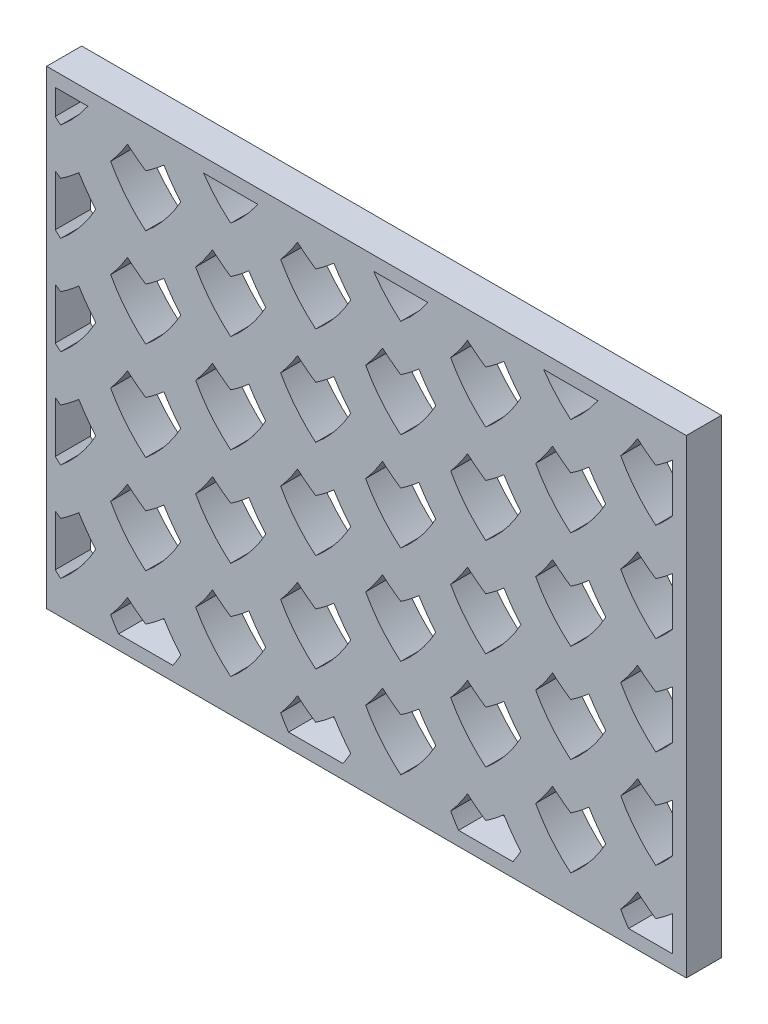
from build123d import *

# Parameters (mm, degrees)
SKETCH3_W           = 88
SKETCH3_H           = 63
BOSS_EXTRUDE2_DEPTH = 5
CUT_EXTRUDE1_DEPTH  = 70.169565835
SKETCH4_W           = 91.228796668
SKETCH4_H           = 67
SKETCH4_W_2         = 88
SKETCH4_H_2         = 63
BOSS_EXTRUDE3_DEPTH = 5


with BuildPart() as part:
    # Sketch3 → Boss-Extrude2 (new body)
    with BuildSketch(Plane.XY):
        with Locations((-6.36239225, 15.649319027)):
            Rectangle(SKETCH3_W, SKETCH3_H)
    extrude(amount=BOSS_EXTRUDE2_DEPTH)

    # Sketch1 → Cut-Extrude1 (cut, through all)
    with BuildSketch(Plane.XY):
        with BuildLine():
            ThreePointArc((-49.591188918, -69.117920678), (-52.373582004, -66.304029643), (-54.591247647, -63.026583512))
            ThreePointArc((-54.591247647, -63.026583512), (-53.31892615, -61.410320298), (-52.185319607, -59.693915634))
            ThreePointArc((-52.185319607, -59.693915634), (-50.921473659, -60.738490347), (-49.591188918, -61.697023298))
            ThreePointArc((-49.591188918, -61.697023298), (-48.260904177, -60.738490347), (-46.997058229, -59.693915634))
            ThreePointArc((-46.997058229, -59.693915634), (-45.863451685, -61.410320298), (-44.591130189, -63.026583512))
            ThreePointArc((-44.591130189, -63.026583512), (-46.808795832, -66.304029643), (-49.591188918, -69.117920678))
        make_face()
        with BuildLine():
            ThreePointArc((-37.466833265, -62.117920678), (-40.249226351, -59.304029643), (-42.466891994, -56.026583512))
            ThreePointArc((-42.466891994, -56.026583512), (-41.194570497, -54.410320298), (-40.060963954, -52.693915634))
            ThreePointArc((-40.060963954, -52.693915634), (-38.797118006, -53.738490347), (-37.466833265, -54.697023298))
            ThreePointArc((-37.466833265, -54.697023298), (-36.136548524, -53.738490347), (-34.872702576, -52.693915634))
            ThreePointArc((-34.872702576, -52.693915634), (-33.739096033, -54.410320298), (-32.466774536, -56.026583512))
            ThreePointArc((-32.466774536, -56.026583512), (-34.684440179, -59.304029643), (-37.466833265, -62.117920678))
        make_face()
        with BuildLine():
            ThreePointArc((-25.342477612, -55.117920678), (-28.124870698, -52.304029643), (-30.342536341, -49.026583512))
            ThreePointArc((-30.342536341, -49.026583512), (-29.070214844, -47.410320298), (-27.936608301, -45.693915634))
            ThreePointArc((-27.936608301, -45.693915634), (-26.672762353, -46.738490347), (-25.342477612, -47.697023298))
            ThreePointArc((-25.342477612, -47.697023298), (-24.012192871, -46.738490347), (-22.748346923, -45.693915634))
            ThreePointArc((-22.748346923, -45.693915634), (-21.61474038, -47.410320298), (-20.342418883, -49.026583512))
            ThreePointArc((-20.342418883, -49.026583512), (-22.560084526, -52.304029643), (-25.342477612, -55.117920678))
        make_face()
        with BuildLine():
            ThreePointArc((-13.218121959, -48.117920678), (-16.000515045, -45.304029643), (-18.218180688, -42.026583512))
            ThreePointArc((-18.218180688, -42.026583512), (-16.945859191, -40.410320298), (-15.812252648, -38.693915634))
            ThreePointArc((-15.812252648, -38.693915634), (-14.5484067, -39.738490347), (-13.218121959, -40.697023298))
            ThreePointArc((-13.218121959, -40.697023298), (-11.887837218, -39.738490347), (-10.62399127, -38.693915634))
            ThreePointArc((-10.62399127, -38.693915634), (-9.490384727, -40.410320298), (-8.21806323, -42.026583512))
            ThreePointArc((-8.21806323, -42.026583512), (-10.435728873, -45.304029643), (-13.218121959, -48.117920678))
        make_face()
        with BuildLine():
            ThreePointArc((-1.093766306, -41.117920678), (-3.876159392, -38.304029643), (-6.093825035, -35.026583512))
            ThreePointArc((-6.093825035, -35.026583512), (-4.821503538, -33.410320298), (-3.687896995, -31.693915634))
            ThreePointArc((-3.687896995, -31.693915634), (-2.424051047, -32.738490347), (-1.093766306, -33.697023298))
            ThreePointArc((-1.093766306, -33.697023298), (0.236518435, -32.738490347), (1.500364383, -31.693915634))
            ThreePointArc((1.500364383, -31.693915634), (2.633970926, -33.410320298), (3.906292423, -35.026583512))
            ThreePointArc((3.906292423, -35.026583512), (1.68862678, -38.304029643), (-1.093766306, -41.117920678))
        make_face()
        with BuildLine():
            ThreePointArc((11.030589347, -34.117920678), (8.248196261, -31.304029643), (6.030530618, -28.026583512))
            ThreePointArc((6.030530618, -28.026583512), (7.302852115, -26.410320298), (8.436458658, -24.693915634))
            ThreePointArc((8.436458658, -24.693915634), (9.700304606, -25.738490347), (11.030589347, -26.697023298))
            ThreePointArc((11.030589347, -26.697023298), (12.360874088, -25.738490347), (13.624720036, -24.693915634))
            ThreePointArc((13.624720036, -24.693915634), (14.758326579, -26.410320298), (16.030648076, -28.026583512))
            ThreePointArc((16.030648076, -28.026583512), (13.812982433, -31.304029643), (11.030589347, -34.117920678))
        make_face()
        with BuildLine():
            ThreePointArc((23.154945, -27.117920678), (20.372551914, -24.304029643), (18.154886271, -21.026583512))
            ThreePointArc((18.154886271, -21.026583512), (19.427207768, -19.410320298), (20.560814311, -17.693915634))
            ThreePointArc((20.560814311, -17.693915634), (21.824660259, -18.738490347), (23.154945, -19.697023298))
            ThreePointArc((23.154945, -19.697023298), (24.485229741, -18.738490347), (25.749075689, -17.693915634))
            ThreePointArc((25.749075689, -17.693915634), (26.882682232, -19.410320298), (28.155003729, -21.026583512))
            ThreePointArc((28.155003729, -21.026583512), (25.937338086, -24.304029643), (23.154945, -27.117920678))
        make_face()
        with BuildLine():
            ThreePointArc((35.279300653, -20.117920678), (32.496907567, -17.304029643), (30.279241924, -14.026583512))
            ThreePointArc((30.279241924, -14.026583512), (31.551563421, -12.410320298), (32.685169964, -10.693915634))
            ThreePointArc((32.685169964, -10.693915634), (33.949015912, -11.738490347), (35.279300653, -12.697023298))
            ThreePointArc((35.279300653, -12.697023298), (36.609585394, -11.738490347), (37.873431342, -10.693915634))
            ThreePointArc((37.873431342, -10.693915634), (39.007037885, -12.410320298), (40.279359382, -14.026583512))
            ThreePointArc((40.279359382, -14.026583512), (38.061693739, -17.304029643), (35.279300653, -20.117920678))
        make_face()
        with BuildLine():
            ThreePointArc((47.403656306, -13.117920678), (44.62126322, -10.304029643), (42.403597577, -7.026583512))
            ThreePointArc((42.403597577, -7.026583512), (43.675919074, -5.410320298), (44.809525617, -3.693915634))
            ThreePointArc((44.809525617, -3.693915634), (46.073371565, -4.738490347), (47.403656306, -5.697023298))
            ThreePointArc((47.403656306, -5.697023298), (48.733941047, -4.738490347), (49.997786995, -3.693915634))
            ThreePointArc((49.997786995, -3.693915634), (51.131393538, -5.410320298), (52.403715035, -7.026583512))
            ThreePointArc((52.403715035, -7.026583512), (50.186049392, -10.304029643), (47.403656306, -13.117920678))
        make_face()
        with BuildLine():
            ThreePointArc((59.528011959, -6.117920678), (56.745618873, -3.304029643), (54.52795323, -0.026583512))
            ThreePointArc((54.52795323, -0.026583512), (55.800274727, 1.589679702), (56.93388127, 3.306084366))
            ThreePointArc((56.93388127, 3.306084366), (58.197727218, 2.261509653), (59.528011959, 1.302976702))
            ThreePointArc((59.528011959, 1.302976702), (60.8582967, 2.261509653), (62.122142648, 3.306084366))
            ThreePointArc((62.122142648, 3.306084366), (63.255749191, 1.589679702), (64.528070688, -0.026583512))
            ThreePointArc((64.528070688, -0.026583512), (62.310405045, -3.304029643), (59.528011959, -6.117920678))
        make_face()
        with BuildLine():
            ThreePointArc((-37.466833265, -48.117920678), (-40.249226351, -45.304029643), (-42.466891994, -42.026583512))
            ThreePointArc((-42.466891994, -42.026583512), (-41.194570497, -40.410320298), (-40.060963954, -38.693915634))
            ThreePointArc((-40.060963954, -38.693915634), (-38.797118006, -39.738490347), (-37.466833265, -40.697023298))
            ThreePointArc((-37.466833265, -40.697023298), (-36.136548524, -39.738490347), (-34.872702576, -38.693915634))
            ThreePointArc((-34.872702576, -38.693915634), (-33.739096033, -40.410320298), (-32.466774536, -42.026583512))
            ThreePointArc((-32.466774536, -42.026583512), (-34.684440179, -45.304029643), (-37.466833265, -48.117920678))
        make_face()
        with BuildLine():
            ThreePointArc((-25.342477612, -41.117920678), (-28.124870698, -38.304029643), (-30.342536341, -35.026583512))
            ThreePointArc((-30.342536341, -35.026583512), (-29.070214844, -33.410320298), (-27.936608301, -31.693915634))
            ThreePointArc((-27.936608301, -31.693915634), (-26.672762353, -32.738490347), (-25.342477612, -33.697023298))
            ThreePointArc((-25.342477612, -33.697023298), (-24.012192871, -32.738490347), (-22.748346923, -31.693915634))
            ThreePointArc((-22.748346923, -31.693915634), (-21.61474038, -33.410320298), (-20.342418883, -35.026583512))
            ThreePointArc((-20.342418883, -35.026583512), (-22.560084526, -38.304029643), (-25.342477612, -41.117920678))
        make_face()
        with BuildLine():
            ThreePointArc((-13.218121959, -34.117920678), (-16.000515045, -31.304029643), (-18.218180688, -28.026583512))
            ThreePointArc((-18.218180688, -28.026583512), (-16.945859191, -26.410320298), (-15.812252648, -24.693915634))
            ThreePointArc((-15.812252648, -24.693915634), (-14.5484067, -25.738490347), (-13.218121959, -26.697023298))
            ThreePointArc((-13.218121959, -26.697023298), (-11.887837218, -25.738490347), (-10.62399127, -24.693915634))
            ThreePointArc((-10.62399127, -24.693915634), (-9.490384727, -26.410320298), (-8.21806323, -28.026583512))
            ThreePointArc((-8.21806323, -28.026583512), (-10.435728873, -31.304029643), (-13.218121959, -34.117920678))
        make_face()
        with BuildLine():
            ThreePointArc((-1.093766306, -27.117920678), (-3.876159392, -24.304029643), (-6.093825035, -21.026583512))
            ThreePointArc((-6.093825035, -21.026583512), (-4.821503538, -19.410320298), (-3.687896995, -17.693915634))
            ThreePointArc((-3.687896995, -17.693915634), (-2.424051047, -18.738490347), (-1.093766306, -19.697023298))
            ThreePointArc((-1.093766306, -19.697023298), (0.236518435, -18.738490347), (1.500364383, -17.693915634))
            ThreePointArc((1.500364383, -17.693915634), (2.633970926, -19.410320298), (3.906292423, -21.026583512))
            ThreePointArc((3.906292423, -21.026583512), (1.68862678, -24.304029643), (-1.093766306, -27.117920678))
        make_face()
        with BuildLine():
            ThreePointArc((11.030589347, -20.117920678), (8.248196261, -17.304029643), (6.030530618, -14.026583512))
            ThreePointArc((6.030530618, -14.026583512), (7.302852115, -12.410320298), (8.436458658, -10.693915634))
            ThreePointArc((8.436458658, -10.693915634), (9.700304606, -11.738490347), (11.030589347, -12.697023298))
            ThreePointArc((11.030589347, -12.697023298), (12.360874088, -11.738490347), (13.624720036, -10.693915634))
            ThreePointArc((13.624720036, -10.693915634), (14.758326579, -12.410320298), (16.030648076, -14.026583512))
            ThreePointArc((16.030648076, -14.026583512), (13.812982433, -17.304029643), (11.030589347, -20.117920678))
        make_face()
        with BuildLine():
            ThreePointArc((23.154945, -13.117920678), (20.372551914, -10.304029643), (18.154886271, -7.026583512))
            ThreePointArc((18.154886271, -7.026583512), (19.427207768, -5.410320298), (20.560814311, -3.693915634))
            ThreePointArc((20.560814311, -3.693915634), (21.824660259, -4.738490347), (23.154945, -5.697023298))
            ThreePointArc((23.154945, -5.697023298), (24.485229741, -4.738490347), (25.749075689, -3.693915634))
            ThreePointArc((25.749075689, -3.693915634), (26.882682232, -5.410320298), (28.155003729, -7.026583512))
            ThreePointArc((28.155003729, -7.026583512), (25.937338086, -10.304029643), (23.154945, -13.117920678))
        make_face()
        with BuildLine():
            ThreePointArc((35.279300653, -6.117920678), (32.496907567, -3.304029643), (30.279241924, -0.026583512))
            ThreePointArc((30.279241924, -0.026583512), (31.551563421, 1.589679702), (32.685169964, 3.306084366))
            ThreePointArc((32.685169964, 3.306084366), (33.949015912, 2.261509653), (35.279300653, 1.302976702))
            ThreePointArc((35.279300653, 1.302976702), (36.609585394, 2.261509653), (37.873431342, 3.306084366))
            ThreePointArc((37.873431342, 3.306084366), (39.007037885, 1.589679702), (40.279359382, -0.026583512))
            ThreePointArc((40.279359382, -0.026583512), (38.061693739, -3.304029643), (35.279300653, -6.117920678))
        make_face()
        with BuildLine():
            ThreePointArc((47.403656306, 0.882079322), (44.62126322, 3.695970357), (42.403597577, 6.973416488))
            ThreePointArc((42.403597577, 6.973416488), (43.675919074, 8.589679702), (44.809525617, 10.306084366))
            ThreePointArc((44.809525617, 10.306084366), (46.073371565, 9.261509653), (47.403656306, 8.302976702))
            ThreePointArc((47.403656306, 8.302976702), (48.733941047, 9.261509653), (49.997786995, 10.306084366))
            ThreePointArc((49.997786995, 10.306084366), (51.131393538, 8.589679702), (52.403715035, 6.973416488))
            ThreePointArc((52.403715035, 6.973416488), (50.186049392, 3.695970357), (47.403656306, 0.882079322))
        make_face()
        with BuildLine():
            ThreePointArc((59.528011959, 7.882079322), (56.745618873, 10.695970357), (54.52795323, 13.973416488))
            ThreePointArc((54.52795323, 13.973416488), (55.800274727, 15.589679702), (56.93388127, 17.306084366))
            ThreePointArc((56.93388127, 17.306084366), (58.197727218, 16.261509653), (59.528011959, 15.302976702))
            ThreePointArc((59.528011959, 15.302976702), (60.8582967, 16.261509653), (62.122142648, 17.306084366))
            ThreePointArc((62.122142648, 17.306084366), (63.255749191, 15.589679702), (64.528070688, 13.973416488))
            ThreePointArc((64.528070688, 13.973416488), (62.310405045, 10.695970357), (59.528011959, 7.882079322))
        make_face()
        with BuildLine():
            ThreePointArc((-37.466833265, -34.117920678), (-40.249226351, -31.304029643), (-42.466891994, -28.026583512))
            ThreePointArc((-42.466891994, -28.026583512), (-41.194570497, -26.410320298), (-40.060963954, -24.693915634))
            ThreePointArc((-40.060963954, -24.693915634), (-38.797118006, -25.738490347), (-37.466833265, -26.697023298))
            ThreePointArc((-37.466833265, -26.697023298), (-36.136548524, -25.738490347), (-34.872702576, -24.693915634))
            ThreePointArc((-34.872702576, -24.693915634), (-33.739096033, -26.410320298), (-32.466774536, -28.026583512))
            ThreePointArc((-32.466774536, -28.026583512), (-34.684440179, -31.304029643), (-37.466833265, -34.117920678))
        make_face()
        with BuildLine():
            ThreePointArc((-25.342477612, -27.117920678), (-28.124870698, -24.304029643), (-30.342536341, -21.026583512))
            ThreePointArc((-30.342536341, -21.026583512), (-29.070214844, -19.410320298), (-27.936608301, -17.693915634))
            ThreePointArc((-27.936608301, -17.693915634), (-26.672762353, -18.738490347), (-25.342477612, -19.697023298))
            ThreePointArc((-25.342477612, -19.697023298), (-24.012192871, -18.738490347), (-22.748346923, -17.693915634))
            ThreePointArc((-22.748346923, -17.693915634), (-21.61474038, -19.410320298), (-20.342418883, -21.026583512))
            ThreePointArc((-20.342418883, -21.026583512), (-22.560084526, -24.304029643), (-25.342477612, -27.117920678))
        make_face()
        with BuildLine():
            ThreePointArc((-13.218121959, -20.117920678), (-16.000515045, -17.304029643), (-18.218180688, -14.026583512))
            ThreePointArc((-18.218180688, -14.026583512), (-16.945859191, -12.410320298), (-15.812252648, -10.693915634))
            ThreePointArc((-15.812252648, -10.693915634), (-14.5484067, -11.738490347), (-13.218121959, -12.697023298))
            ThreePointArc((-13.218121959, -12.697023298), (-11.887837218, -11.738490347), (-10.62399127, -10.693915634))
            ThreePointArc((-10.62399127, -10.693915634), (-9.490384727, -12.410320298), (-8.21806323, -14.026583512))
            ThreePointArc((-8.21806323, -14.026583512), (-10.435728873, -17.304029643), (-13.218121959, -20.117920678))
        make_face()
        with BuildLine():
            ThreePointArc((-1.093766306, -13.117920678), (-3.876159392, -10.304029643), (-6.093825035, -7.026583512))
            ThreePointArc((-6.093825035, -7.026583512), (-4.821503538, -5.410320298), (-3.687896995, -3.693915634))
            ThreePointArc((-3.687896995, -3.693915634), (-2.424051047, -4.738490347), (-1.093766306, -5.697023298))
            ThreePointArc((-1.093766306, -5.697023298), (0.236518435, -4.738490347), (1.500364383, -3.693915634))
            ThreePointArc((1.500364383, -3.693915634), (2.633970926, -5.410320298), (3.906292423, -7.026583512))
            ThreePointArc((3.906292423, -7.026583512), (1.68862678, -10.304029643), (-1.093766306, -13.117920678))
        make_face()
        with BuildLine():
            ThreePointArc((11.030589347, -6.117920678), (8.248196261, -3.304029643), (6.030530618, -0.026583512))
            ThreePointArc((6.030530618, -0.026583512), (7.302852115, 1.589679702), (8.436458658, 3.306084366))
            ThreePointArc((8.436458658, 3.306084366), (9.700304606, 2.261509653), (11.030589347, 1.302976702))
            ThreePointArc((11.030589347, 1.302976702), (12.360874088, 2.261509653), (13.624720036, 3.306084366))
            ThreePointArc((13.624720036, 3.306084366), (14.758326579, 1.589679702), (16.030648076, -0.026583512))
            ThreePointArc((16.030648076, -0.026583512), (13.812982433, -3.304029643), (11.030589347, -6.117920678))
        make_face()
        with BuildLine():
            ThreePointArc((23.154945, 0.882079322), (20.372551914, 3.695970357), (18.154886271, 6.973416488))
            ThreePointArc((18.154886271, 6.973416488), (19.427207768, 8.589679702), (20.560814311, 10.306084366))
            ThreePointArc((20.560814311, 10.306084366), (21.824660259, 9.261509653), (23.154945, 8.302976702))
            ThreePointArc((23.154945, 8.302976702), (24.485229741, 9.261509653), (25.749075689, 10.306084366))
            ThreePointArc((25.749075689, 10.306084366), (26.882682232, 8.589679702), (28.155003729, 6.973416488))
            ThreePointArc((28.155003729, 6.973416488), (25.937338086, 3.695970357), (23.154945, 0.882079322))
        make_face()
        with BuildLine():
            ThreePointArc((35.279300653, 7.882079322), (32.496907567, 10.695970357), (30.279241924, 13.973416488))
            ThreePointArc((30.279241924, 13.973416488), (31.551563421, 15.589679702), (32.685169964, 17.306084366))
            ThreePointArc((32.685169964, 17.306084366), (33.949015912, 16.261509653), (35.279300653, 15.302976702))
            ThreePointArc((35.279300653, 15.302976702), (36.609585394, 16.261509653), (37.873431342, 17.306084366))
            ThreePointArc((37.873431342, 17.306084366), (39.007037885, 15.589679702), (40.279359382, 13.973416488))
            ThreePointArc((40.279359382, 13.973416488), (38.061693739, 10.695970357), (35.279300653, 7.882079322))
        make_face()
        with BuildLine():
            ThreePointArc((47.403656306, 14.882079322), (44.62126322, 17.695970357), (42.403597577, 20.973416488))
            ThreePointArc((42.403597577, 20.973416488), (43.675919074, 22.589679702), (44.809525617, 24.306084366))
            ThreePointArc((44.809525617, 24.306084366), (46.073371565, 23.261509653), (47.403656306, 22.302976702))
            ThreePointArc((47.403656306, 22.302976702), (48.733941047, 23.261509653), (49.997786995, 24.306084366))
            ThreePointArc((49.997786995, 24.306084366), (51.131393538, 22.589679702), (52.403715035, 20.973416488))
            ThreePointArc((52.403715035, 20.973416488), (50.186049392, 17.695970357), (47.403656306, 14.882079322))
        make_face()
        with BuildLine():
            ThreePointArc((59.528011959, 21.882079322), (56.745618873, 24.695970357), (54.52795323, 27.973416488))
            ThreePointArc((54.52795323, 27.973416488), (55.800274727, 29.589679702), (56.93388127, 31.306084366))
            ThreePointArc((56.93388127, 31.306084366), (58.197727218, 30.261509653), (59.528011959, 29.302976702))
            ThreePointArc((59.528011959, 29.302976702), (60.8582967, 30.261509653), (62.122142648, 31.306084366))
            ThreePointArc((62.122142648, 31.306084366), (63.255749191, 29.589679702), (64.528070688, 27.973416488))
            ThreePointArc((64.528070688, 27.973416488), (62.310405045, 24.695970357), (59.528011959, 21.882079322))
        make_face()
        with BuildLine():
            ThreePointArc((-37.466833265, -20.117920678), (-40.249226351, -17.304029643), (-42.466891994, -14.026583512))
            ThreePointArc((-42.466891994, -14.026583512), (-41.194570497, -12.410320298), (-40.060963954, -10.693915634))
            ThreePointArc((-40.060963954, -10.693915634), (-38.797118006, -11.738490347), (-37.466833265, -12.697023298))
            ThreePointArc((-37.466833265, -12.697023298), (-36.136548524, -11.738490347), (-34.872702576, -10.693915634))
            ThreePointArc((-34.872702576, -10.693915634), (-33.739096033, -12.410320298), (-32.466774536, -14.026583512))
            ThreePointArc((-32.466774536, -14.026583512), (-34.684440179, -17.304029643), (-37.466833265, -20.117920678))
        make_face()
        with BuildLine():
            ThreePointArc((-25.342477612, -13.117920678), (-28.124870698, -10.304029643), (-30.342536341, -7.026583512))
            ThreePointArc((-30.342536341, -7.026583512), (-29.070214844, -5.410320298), (-27.936608301, -3.693915634))
            ThreePointArc((-27.936608301, -3.693915634), (-26.672762353, -4.738490347), (-25.342477612, -5.697023298))
            ThreePointArc((-25.342477612, -5.697023298), (-24.012192871, -4.738490347), (-22.748346923, -3.693915634))
            ThreePointArc((-22.748346923, -3.693915634), (-21.61474038, -5.410320298), (-20.342418883, -7.026583512))
            ThreePointArc((-20.342418883, -7.026583512), (-22.560084526, -10.304029643), (-25.342477612, -13.117920678))
        make_face()
        with BuildLine():
            ThreePointArc((-13.218121959, -6.117920678), (-16.000515045, -3.304029643), (-18.218180688, -0.026583512))
            ThreePointArc((-18.218180688, -0.026583512), (-16.945859191, 1.589679702), (-15.812252648, 3.306084366))
            ThreePointArc((-15.812252648, 3.306084366), (-14.5484067, 2.261509653), (-13.218121959, 1.302976702))
            ThreePointArc((-13.218121959, 1.302976702), (-11.887837218, 2.261509653), (-10.62399127, 3.306084366))
            ThreePointArc((-10.62399127, 3.306084366), (-9.490384727, 1.589679702), (-8.21806323, -0.026583512))
            ThreePointArc((-8.21806323, -0.026583512), (-10.435728873, -3.304029643), (-13.218121959, -6.117920678))
        make_face()
        with BuildLine():
            ThreePointArc((-1.093766306, 0.882079322), (-3.876159392, 3.695970357), (-6.093825035, 6.973416488))
            ThreePointArc((-6.093825035, 6.973416488), (-4.821503538, 8.589679702), (-3.687896995, 10.306084366))
            ThreePointArc((-3.687896995, 10.306084366), (-2.424051047, 9.261509653), (-1.093766306, 8.302976702))
            ThreePointArc((-1.093766306, 8.302976702), (0.236518435, 9.261509653), (1.500364383, 10.306084366))
            ThreePointArc((1.500364383, 10.306084366), (2.633970926, 8.589679702), (3.906292423, 6.973416488))
            ThreePointArc((3.906292423, 6.973416488), (1.68862678, 3.695970357), (-1.093766306, 0.882079322))
        make_face()
        with BuildLine():
            ThreePointArc((11.030589347, 7.882079322), (8.248196261, 10.695970357), (6.030530618, 13.973416488))
            ThreePointArc((6.030530618, 13.973416488), (7.302852115, 15.589679702), (8.436458658, 17.306084366))
            ThreePointArc((8.436458658, 17.306084366), (9.700304606, 16.261509653), (11.030589347, 15.302976702))
            ThreePointArc((11.030589347, 15.302976702), (12.360874088, 16.261509653), (13.624720036, 17.306084366))
            ThreePointArc((13.624720036, 17.306084366), (14.758326579, 15.589679702), (16.030648076, 13.973416488))
            ThreePointArc((16.030648076, 13.973416488), (13.812982433, 10.695970357), (11.030589347, 7.882079322))
        make_face()
        with BuildLine():
            ThreePointArc((23.154945, 14.882079322), (20.372551914, 17.695970357), (18.154886271, 20.973416488))
            ThreePointArc((18.154886271, 20.973416488), (19.427207768, 22.589679702), (20.560814311, 24.306084366))
            ThreePointArc((20.560814311, 24.306084366), (21.824660259, 23.261509653), (23.154945, 22.302976702))
            ThreePointArc((23.154945, 22.302976702), (24.485229741, 23.261509653), (25.749075689, 24.306084366))
            ThreePointArc((25.749075689, 24.306084366), (26.882682232, 22.589679702), (28.155003729, 20.973416488))
            ThreePointArc((28.155003729, 20.973416488), (25.937338086, 17.695970357), (23.154945, 14.882079322))
        make_face()
        with BuildLine():
            ThreePointArc((35.279300653, 21.882079322), (32.496907567, 24.695970357), (30.279241924, 27.973416488))
            ThreePointArc((30.279241924, 27.973416488), (31.551563421, 29.589679702), (32.685169964, 31.306084366))
            ThreePointArc((32.685169964, 31.306084366), (33.949015912, 30.261509653), (35.279300653, 29.302976702))
            ThreePointArc((35.279300653, 29.302976702), (36.609585394, 30.261509653), (37.873431342, 31.306084366))
            ThreePointArc((37.873431342, 31.306084366), (39.007037885, 29.589679702), (40.279359382, 27.973416488))
            ThreePointArc((40.279359382, 27.973416488), (38.061693739, 24.695970357), (35.279300653, 21.882079322))
        make_face()
        with BuildLine():
            ThreePointArc((47.403656306, 28.882079322), (44.62126322, 31.695970357), (42.403597577, 34.973416488))
            ThreePointArc((42.403597577, 34.973416488), (43.675919074, 36.589679702), (44.809525617, 38.306084366))
            ThreePointArc((44.809525617, 38.306084366), (46.073371565, 37.261509653), (47.403656306, 36.302976702))
            ThreePointArc((47.403656306, 36.302976702), (48.733941047, 37.261509653), (49.997786995, 38.306084366))
            ThreePointArc((49.997786995, 38.306084366), (51.131393538, 36.589679702), (52.403715035, 34.973416488))
            ThreePointArc((52.403715035, 34.973416488), (50.186049392, 31.695970357), (47.403656306, 28.882079322))
        make_face()
        with BuildLine():
            ThreePointArc((59.528011959, 35.882079322), (56.745618873, 38.695970357), (54.52795323, 41.973416488))
            ThreePointArc((54.52795323, 41.973416488), (55.800274727, 43.589679702), (56.93388127, 45.306084366))
            ThreePointArc((56.93388127, 45.306084366), (58.197727218, 44.261509653), (59.528011959, 43.302976702))
            ThreePointArc((59.528011959, 43.302976702), (60.8582967, 44.261509653), (62.122142648, 45.306084366))
            ThreePointArc((62.122142648, 45.306084366), (63.255749191, 43.589679702), (64.528070688, 41.973416488))
            ThreePointArc((64.528070688, 41.973416488), (62.310405045, 38.695970357), (59.528011959, 35.882079322))
        make_face()
        with BuildLine():
            ThreePointArc((-37.466833265, -6.117920678), (-40.249226351, -3.304029643), (-42.466891994, -0.026583512))
            ThreePointArc((-42.466891994, -0.026583512), (-41.194570497, 1.589679702), (-40.060963954, 3.306084366))
            ThreePointArc((-40.060963954, 3.306084366), (-38.797118006, 2.261509653), (-37.466833265, 1.302976702))
            ThreePointArc((-37.466833265, 1.302976702), (-36.136548524, 2.261509653), (-34.872702576, 3.306084366))
            ThreePointArc((-34.872702576, 3.306084366), (-33.739096033, 1.589679702), (-32.466774536, -0.026583512))
            ThreePointArc((-32.466774536, -0.026583512), (-34.684440179, -3.304029643), (-37.466833265, -6.117920678))
        make_face()
        with BuildLine():
            ThreePointArc((-25.342477612, 0.882079322), (-28.124870698, 3.695970357), (-30.342536341, 6.973416488))
            ThreePointArc((-30.342536341, 6.973416488), (-29.070214844, 8.589679702), (-27.936608301, 10.306084366))
            ThreePointArc((-27.936608301, 10.306084366), (-26.672762353, 9.261509653), (-25.342477612, 8.302976702))
            ThreePointArc((-25.342477612, 8.302976702), (-24.012192871, 9.261509653), (-22.748346923, 10.306084366))
            ThreePointArc((-22.748346923, 10.306084366), (-21.61474038, 8.589679702), (-20.342418883, 6.973416488))
            ThreePointArc((-20.342418883, 6.973416488), (-22.560084526, 3.695970357), (-25.342477612, 0.882079322))
        make_face()
        with BuildLine():
            ThreePointArc((-13.218121959, 7.882079322), (-16.000515045, 10.695970357), (-18.218180688, 13.973416488))
            ThreePointArc((-18.218180688, 13.973416488), (-16.945859191, 15.589679702), (-15.812252648, 17.306084366))
            ThreePointArc((-15.812252648, 17.306084366), (-14.5484067, 16.261509653), (-13.218121959, 15.302976702))
            ThreePointArc((-13.218121959, 15.302976702), (-11.887837218, 16.261509653), (-10.62399127, 17.306084366))
            ThreePointArc((-10.62399127, 17.306084366), (-9.490384727, 15.589679702), (-8.21806323, 13.973416488))
            ThreePointArc((-8.21806323, 13.973416488), (-10.435728873, 10.695970357), (-13.218121959, 7.882079322))
        make_face()
        with BuildLine():
            ThreePointArc((-1.093766306, 14.882079322), (-3.876159392, 17.695970357), (-6.093825035, 20.973416488))
            ThreePointArc((-6.093825035, 20.973416488), (-4.821503538, 22.589679702), (-3.687896995, 24.306084366))
            ThreePointArc((-3.687896995, 24.306084366), (-2.424051047, 23.261509653), (-1.093766306, 22.302976702))
            ThreePointArc((-1.093766306, 22.302976702), (0.236518435, 23.261509653), (1.500364383, 24.306084366))
            ThreePointArc((1.500364383, 24.306084366), (2.633970926, 22.589679702), (3.906292423, 20.973416488))
            ThreePointArc((3.906292423, 20.973416488), (1.68862678, 17.695970357), (-1.093766306, 14.882079322))
        make_face()
        with BuildLine():
            ThreePointArc((11.030589347, 21.882079322), (8.248196261, 24.695970357), (6.030530618, 27.973416488))
            ThreePointArc((6.030530618, 27.973416488), (7.302852115, 29.589679702), (8.436458658, 31.306084366))
            ThreePointArc((8.436458658, 31.306084366), (9.700304606, 30.261509653), (11.030589347, 29.302976702))
            ThreePointArc((11.030589347, 29.302976702), (12.360874088, 30.261509653), (13.624720036, 31.306084366))
            ThreePointArc((13.624720036, 31.306084366), (14.758326579, 29.589679702), (16.030648076, 27.973416488))
            ThreePointArc((16.030648076, 27.973416488), (13.812982433, 24.695970357), (11.030589347, 21.882079322))
        make_face()
        with BuildLine():
            ThreePointArc((23.154945, 28.882079322), (20.372551914, 31.695970357), (18.154886271, 34.973416488))
            ThreePointArc((18.154886271, 34.973416488), (19.427207768, 36.589679702), (20.560814311, 38.306084366))
            ThreePointArc((20.560814311, 38.306084366), (21.824660259, 37.261509653), (23.154945, 36.302976702))
            ThreePointArc((23.154945, 36.302976702), (24.485229741, 37.261509653), (25.749075689, 38.306084366))
            ThreePointArc((25.749075689, 38.306084366), (26.882682232, 36.589679702), (28.155003729, 34.973416488))
            ThreePointArc((28.155003729, 34.973416488), (25.937338086, 31.695970357), (23.154945, 28.882079322))
        make_face()
        with BuildLine():
            ThreePointArc((35.279300653, 35.882079322), (32.496907567, 38.695970357), (30.279241924, 41.973416488))
            ThreePointArc((30.279241924, 41.973416488), (31.551563421, 43.589679702), (32.685169964, 45.306084366))
            ThreePointArc((32.685169964, 45.306084366), (33.949015912, 44.261509653), (35.279300653, 43.302976702))
            ThreePointArc((35.279300653, 43.302976702), (36.609585394, 44.261509653), (37.873431342, 45.306084366))
            ThreePointArc((37.873431342, 45.306084366), (39.007037885, 43.589679702), (40.279359382, 41.973416488))
            ThreePointArc((40.279359382, 41.973416488), (38.061693739, 38.695970357), (35.279300653, 35.882079322))
        make_face()
        with BuildLine():
            ThreePointArc((47.403656306, 42.882079322), (44.62126322, 45.695970357), (42.403597577, 48.973416488))
            ThreePointArc((42.403597577, 48.973416488), (43.675919074, 50.589679702), (44.809525617, 52.306084366))
            ThreePointArc((44.809525617, 52.306084366), (46.073371565, 51.261509653), (47.403656306, 50.302976702))
            ThreePointArc((47.403656306, 50.302976702), (48.733941047, 51.261509653), (49.997786995, 52.306084366))
            ThreePointArc((49.997786995, 52.306084366), (51.131393538, 50.589679702), (52.403715035, 48.973416488))
            ThreePointArc((52.403715035, 48.973416488), (50.186049392, 45.695970357), (47.403656306, 42.882079322))
        make_face()
        with BuildLine():
            ThreePointArc((59.528011959, 49.882079322), (56.745618873, 52.695970357), (54.52795323, 55.973416488))
            ThreePointArc((54.52795323, 55.973416488), (55.800274727, 57.589679702), (56.93388127, 59.306084366))
            ThreePointArc((56.93388127, 59.306084366), (58.197727218, 58.261509653), (59.528011959, 57.302976702))
            ThreePointArc((59.528011959, 57.302976702), (60.8582967, 58.261509653), (62.122142648, 59.306084366))
            ThreePointArc((62.122142648, 59.306084366), (63.255749191, 57.589679702), (64.528070688, 55.973416488))
            ThreePointArc((64.528070688, 55.973416488), (62.310405045, 52.695970357), (59.528011959, 49.882079322))
        make_face()
        with BuildLine():
            ThreePointArc((-37.466833265, 7.882079322), (-40.249226351, 10.695970357), (-42.466891994, 13.973416488))
            ThreePointArc((-42.466891994, 13.973416488), (-41.194570497, 15.589679702), (-40.060963954, 17.306084366))
            ThreePointArc((-40.060963954, 17.306084366), (-38.797118006, 16.261509653), (-37.466833265, 15.302976702))
            ThreePointArc((-37.466833265, 15.302976702), (-36.136548524, 16.261509653), (-34.872702576, 17.306084366))
            ThreePointArc((-34.872702576, 17.306084366), (-33.739096033, 15.589679702), (-32.466774536, 13.973416488))
            ThreePointArc((-32.466774536, 13.973416488), (-34.684440179, 10.695970357), (-37.466833265, 7.882079322))
        make_face()
        with BuildLine():
            ThreePointArc((-25.342477612, 14.882079322), (-28.124870698, 17.695970357), (-30.342536341, 20.973416488))
            ThreePointArc((-30.342536341, 20.973416488), (-29.070214844, 22.589679702), (-27.936608301, 24.306084366))
            ThreePointArc((-27.936608301, 24.306084366), (-26.672762353, 23.261509653), (-25.342477612, 22.302976702))
            ThreePointArc((-25.342477612, 22.302976702), (-24.012192871, 23.261509653), (-22.748346923, 24.306084366))
            ThreePointArc((-22.748346923, 24.306084366), (-21.61474038, 22.589679702), (-20.342418883, 20.973416488))
            ThreePointArc((-20.342418883, 20.973416488), (-22.560084526, 17.695970357), (-25.342477612, 14.882079322))
        make_face()
        with BuildLine():
            ThreePointArc((-13.218121959, 21.882079322), (-16.000515045, 24.695970357), (-18.218180688, 27.973416488))
            ThreePointArc((-18.218180688, 27.973416488), (-16.945859191, 29.589679702), (-15.812252648, 31.306084366))
            ThreePointArc((-15.812252648, 31.306084366), (-14.5484067, 30.261509653), (-13.218121959, 29.302976702))
            ThreePointArc((-13.218121959, 29.302976702), (-11.887837218, 30.261509653), (-10.62399127, 31.306084366))
            ThreePointArc((-10.62399127, 31.306084366), (-9.490384727, 29.589679702), (-8.21806323, 27.973416488))
            ThreePointArc((-8.21806323, 27.973416488), (-10.435728873, 24.695970357), (-13.218121959, 21.882079322))
        make_face()
        with BuildLine():
            ThreePointArc((-1.093766306, 28.882079322), (-3.876159392, 31.695970357), (-6.093825035, 34.973416488))
            ThreePointArc((-6.093825035, 34.973416488), (-4.821503538, 36.589679702), (-3.687896995, 38.306084366))
            ThreePointArc((-3.687896995, 38.306084366), (-2.424051047, 37.261509653), (-1.093766306, 36.302976702))
            ThreePointArc((-1.093766306, 36.302976702), (0.236518435, 37.261509653), (1.500364383, 38.306084366))
            ThreePointArc((1.500364383, 38.306084366), (2.633970926, 36.589679702), (3.906292423, 34.973416488))
            ThreePointArc((3.906292423, 34.973416488), (1.68862678, 31.695970357), (-1.093766306, 28.882079322))
        make_face()
        with BuildLine():
            ThreePointArc((11.030589347, 35.882079322), (8.248196261, 38.695970357), (6.030530618, 41.973416488))
            ThreePointArc((6.030530618, 41.973416488), (7.302852115, 43.589679702), (8.436458658, 45.306084366))
            ThreePointArc((8.436458658, 45.306084366), (9.700304606, 44.261509653), (11.030589347, 43.302976702))
            ThreePointArc((11.030589347, 43.302976702), (12.360874088, 44.261509653), (13.624720036, 45.306084366))
            ThreePointArc((13.624720036, 45.306084366), (14.758326579, 43.589679702), (16.030648076, 41.973416488))
            ThreePointArc((16.030648076, 41.973416488), (13.812982433, 38.695970357), (11.030589347, 35.882079322))
        make_face()
        with BuildLine():
            ThreePointArc((23.154945, 42.882079322), (20.372551914, 45.695970357), (18.154886271, 48.973416488))
            ThreePointArc((18.154886271, 48.973416488), (19.427207768, 50.589679702), (20.560814311, 52.306084366))
            ThreePointArc((20.560814311, 52.306084366), (21.824660259, 51.261509653), (23.154945, 50.302976702))
            ThreePointArc((23.154945, 50.302976702), (24.485229741, 51.261509653), (25.749075689, 52.306084366))
            ThreePointArc((25.749075689, 52.306084366), (26.882682232, 50.589679702), (28.155003729, 48.973416488))
            ThreePointArc((28.155003729, 48.973416488), (25.937338086, 45.695970357), (23.154945, 42.882079322))
        make_face()
        with BuildLine():
            ThreePointArc((35.279300653, 49.882079322), (32.496907567, 52.695970357), (30.279241924, 55.973416488))
            ThreePointArc((30.279241924, 55.973416488), (31.551563421, 57.589679702), (32.685169964, 59.306084366))
            ThreePointArc((32.685169964, 59.306084366), (33.949015912, 58.261509653), (35.279300653, 57.302976702))
            ThreePointArc((35.279300653, 57.302976702), (36.609585394, 58.261509653), (37.873431342, 59.306084366))
            ThreePointArc((37.873431342, 59.306084366), (39.007037885, 57.589679702), (40.279359382, 55.973416488))
            ThreePointArc((40.279359382, 55.973416488), (38.061693739, 52.695970357), (35.279300653, 49.882079322))
        make_face()
        with BuildLine():
            ThreePointArc((47.403656306, 56.882079322), (44.62126322, 59.695970357), (42.403597577, 62.973416488))
            ThreePointArc((42.403597577, 62.973416488), (43.675919074, 64.589679702), (44.809525617, 66.306084366))
            ThreePointArc((44.809525617, 66.306084366), (46.073371565, 65.261509653), (47.403656306, 64.302976702))
            ThreePointArc((47.403656306, 64.302976702), (48.733941047, 65.261509653), (49.997786995, 66.306084366))
            ThreePointArc((49.997786995, 66.306084366), (51.131393538, 64.589679702), (52.403715035, 62.973416488))
            ThreePointArc((52.403715035, 62.973416488), (50.186049392, 59.695970357), (47.403656306, 56.882079322))
        make_face()
        with BuildLine():
            ThreePointArc((59.528011959, 63.882079322), (56.745618873, 66.695970357), (54.52795323, 69.973416488))
            ThreePointArc((54.52795323, 69.973416488), (55.800274727, 71.589679702), (56.93388127, 73.306084366))
            ThreePointArc((56.93388127, 73.306084366), (58.197727218, 72.261509653), (59.528011959, 71.302976702))
            ThreePointArc((59.528011959, 71.302976702), (60.8582967, 72.261509653), (62.122142648, 73.306084366))
            ThreePointArc((62.122142648, 73.306084366), (63.255749191, 71.589679702), (64.528070688, 69.973416488))
            ThreePointArc((64.528070688, 69.973416488), (62.310405045, 66.695970357), (59.528011959, 63.882079322))
        make_face()
        with BuildLine():
            ThreePointArc((-37.466833265, 21.882079322), (-40.249226351, 24.695970357), (-42.466891994, 27.973416488))
            ThreePointArc((-42.466891994, 27.973416488), (-41.194570497, 29.589679702), (-40.060963954, 31.306084366))
            ThreePointArc((-40.060963954, 31.306084366), (-38.797118006, 30.261509653), (-37.466833265, 29.302976702))
            ThreePointArc((-37.466833265, 29.302976702), (-36.136548524, 30.261509653), (-34.872702576, 31.306084366))
            ThreePointArc((-34.872702576, 31.306084366), (-33.739096033, 29.589679702), (-32.466774536, 27.973416488))
            ThreePointArc((-32.466774536, 27.973416488), (-34.684440179, 24.695970357), (-37.466833265, 21.882079322))
        make_face()
        with BuildLine():
            ThreePointArc((-25.342477612, 28.882079322), (-28.124870698, 31.695970357), (-30.342536341, 34.973416488))
            ThreePointArc((-30.342536341, 34.973416488), (-29.070214844, 36.589679702), (-27.936608301, 38.306084366))
            ThreePointArc((-27.936608301, 38.306084366), (-26.672762353, 37.261509653), (-25.342477612, 36.302976702))
            ThreePointArc((-25.342477612, 36.302976702), (-24.012192871, 37.261509653), (-22.748346923, 38.306084366))
            ThreePointArc((-22.748346923, 38.306084366), (-21.61474038, 36.589679702), (-20.342418883, 34.973416488))
            ThreePointArc((-20.342418883, 34.973416488), (-22.560084526, 31.695970357), (-25.342477612, 28.882079322))
        make_face()
        with BuildLine():
            ThreePointArc((-13.218121959, 35.882079322), (-16.000515045, 38.695970357), (-18.218180688, 41.973416488))
            ThreePointArc((-18.218180688, 41.973416488), (-16.945859191, 43.589679702), (-15.812252648, 45.306084366))
            ThreePointArc((-15.812252648, 45.306084366), (-14.5484067, 44.261509653), (-13.218121959, 43.302976702))
            ThreePointArc((-13.218121959, 43.302976702), (-11.887837218, 44.261509653), (-10.62399127, 45.306084366))
            ThreePointArc((-10.62399127, 45.306084366), (-9.490384727, 43.589679702), (-8.21806323, 41.973416488))
            ThreePointArc((-8.21806323, 41.973416488), (-10.435728873, 38.695970357), (-13.218121959, 35.882079322))
        make_face()
        with BuildLine():
            ThreePointArc((-1.093766306, 42.882079322), (-3.876159392, 45.695970357), (-6.093825035, 48.973416488))
            ThreePointArc((-6.093825035, 48.973416488), (-4.821503538, 50.589679702), (-3.687896995, 52.306084366))
            ThreePointArc((-3.687896995, 52.306084366), (-2.424051047, 51.261509653), (-1.093766306, 50.302976702))
            ThreePointArc((-1.093766306, 50.302976702), (0.236518435, 51.261509653), (1.500364383, 52.306084366))
            ThreePointArc((1.500364383, 52.306084366), (2.633970926, 50.589679702), (3.906292423, 48.973416488))
            ThreePointArc((3.906292423, 48.973416488), (1.68862678, 45.695970357), (-1.093766306, 42.882079322))
        make_face()
        with BuildLine():
            ThreePointArc((11.030589347, 49.882079322), (8.248196261, 52.695970357), (6.030530618, 55.973416488))
            ThreePointArc((6.030530618, 55.973416488), (7.302852115, 57.589679702), (8.436458658, 59.306084366))
            ThreePointArc((8.436458658, 59.306084366), (9.700304606, 58.261509653), (11.030589347, 57.302976702))
            ThreePointArc((11.030589347, 57.302976702), (12.360874088, 58.261509653), (13.624720036, 59.306084366))
            ThreePointArc((13.624720036, 59.306084366), (14.758326579, 57.589679702), (16.030648076, 55.973416488))
            ThreePointArc((16.030648076, 55.973416488), (13.812982433, 52.695970357), (11.030589347, 49.882079322))
        make_face()
        with BuildLine():
            ThreePointArc((23.154945, 56.882079322), (20.372551914, 59.695970357), (18.154886271, 62.973416488))
            ThreePointArc((18.154886271, 62.973416488), (19.427207768, 64.589679702), (20.560814311, 66.306084366))
            ThreePointArc((20.560814311, 66.306084366), (21.824660259, 65.261509653), (23.154945, 64.302976702))
            ThreePointArc((23.154945, 64.302976702), (24.485229741, 65.261509653), (25.749075689, 66.306084366))
            ThreePointArc((25.749075689, 66.306084366), (26.882682232, 64.589679702), (28.155003729, 62.973416488))
            ThreePointArc((28.155003729, 62.973416488), (25.937338086, 59.695970357), (23.154945, 56.882079322))
        make_face()
        with BuildLine():
            ThreePointArc((35.279300653, 63.882079322), (32.496907567, 66.695970357), (30.279241924, 69.973416488))
            ThreePointArc((30.279241924, 69.973416488), (31.551563421, 71.589679702), (32.685169964, 73.306084366))
            ThreePointArc((32.685169964, 73.306084366), (33.949015912, 72.261509653), (35.279300653, 71.302976702))
            ThreePointArc((35.279300653, 71.302976702), (36.609585394, 72.261509653), (37.873431342, 73.306084366))
            ThreePointArc((37.873431342, 73.306084366), (39.007037885, 71.589679702), (40.279359382, 69.973416488))
            ThreePointArc((40.279359382, 69.973416488), (38.061693739, 66.695970357), (35.279300653, 63.882079322))
        make_face()
        with BuildLine():
            ThreePointArc((47.403656306, 70.882079322), (44.62126322, 73.695970357), (42.403597577, 76.973416488))
            ThreePointArc((42.403597577, 76.973416488), (43.675919074, 78.589679702), (44.809525617, 80.306084366))
            ThreePointArc((44.809525617, 80.306084366), (46.073371565, 79.261509653), (47.403656306, 78.302976702))
            ThreePointArc((47.403656306, 78.302976702), (48.733941047, 79.261509653), (49.997786995, 80.306084366))
            ThreePointArc((49.997786995, 80.306084366), (51.131393538, 78.589679702), (52.403715035, 76.973416488))
            ThreePointArc((52.403715035, 76.973416488), (50.186049392, 73.695970357), (47.403656306, 70.882079322))
        make_face()
        with BuildLine():
            ThreePointArc((59.528011959, 77.882079322), (56.745618873, 80.695970357), (54.52795323, 83.973416488))
            ThreePointArc((54.52795323, 83.973416488), (55.800274727, 85.589679702), (56.93388127, 87.306084366))
            ThreePointArc((56.93388127, 87.306084366), (58.197727218, 86.261509653), (59.528011959, 85.302976702))
            ThreePointArc((59.528011959, 85.302976702), (60.8582967, 86.261509653), (62.122142648, 87.306084366))
            ThreePointArc((62.122142648, 87.306084366), (63.255749191, 85.589679702), (64.528070688, 83.973416488))
            ThreePointArc((64.528070688, 83.973416488), (62.310405045, 80.695970357), (59.528011959, 77.882079322))
        make_face()
        with BuildLine():
            ThreePointArc((-37.466833265, 35.882079322), (-40.249226351, 38.695970357), (-42.466891994, 41.973416488))
            ThreePointArc((-42.466891994, 41.973416488), (-41.194570497, 43.589679702), (-40.060963954, 45.306084366))
            ThreePointArc((-40.060963954, 45.306084366), (-38.797118006, 44.261509653), (-37.466833265, 43.302976702))
            ThreePointArc((-37.466833265, 43.302976702), (-36.136548524, 44.261509653), (-34.872702576, 45.306084366))
            ThreePointArc((-34.872702576, 45.306084366), (-33.739096033, 43.589679702), (-32.466774536, 41.973416488))
            ThreePointArc((-32.466774536, 41.973416488), (-34.684440179, 38.695970357), (-37.466833265, 35.882079322))
        make_face()
        with BuildLine():
            ThreePointArc((-25.342477612, 42.882079322), (-28.124870698, 45.695970357), (-30.342536341, 48.973416488))
            ThreePointArc((-30.342536341, 48.973416488), (-29.070214844, 50.589679702), (-27.936608301, 52.306084366))
            ThreePointArc((-27.936608301, 52.306084366), (-26.672762353, 51.261509653), (-25.342477612, 50.302976702))
            ThreePointArc((-25.342477612, 50.302976702), (-24.012192871, 51.261509653), (-22.748346923, 52.306084366))
            ThreePointArc((-22.748346923, 52.306084366), (-21.61474038, 50.589679702), (-20.342418883, 48.973416488))
            ThreePointArc((-20.342418883, 48.973416488), (-22.560084526, 45.695970357), (-25.342477612, 42.882079322))
        make_face()
        with BuildLine():
            ThreePointArc((-13.218121959, 49.882079322), (-16.000515045, 52.695970357), (-18.218180688, 55.973416488))
            ThreePointArc((-18.218180688, 55.973416488), (-16.945859191, 57.589679702), (-15.812252648, 59.306084366))
            ThreePointArc((-15.812252648, 59.306084366), (-14.5484067, 58.261509653), (-13.218121959, 57.302976702))
            ThreePointArc((-13.218121959, 57.302976702), (-11.887837218, 58.261509653), (-10.62399127, 59.306084366))
            ThreePointArc((-10.62399127, 59.306084366), (-9.490384727, 57.589679702), (-8.21806323, 55.973416488))
            ThreePointArc((-8.21806323, 55.973416488), (-10.435728873, 52.695970357), (-13.218121959, 49.882079322))
        make_face()
        with BuildLine():
            ThreePointArc((-1.093766306, 56.882079322), (-3.876159392, 59.695970357), (-6.093825035, 62.973416488))
            ThreePointArc((-6.093825035, 62.973416488), (-4.821503538, 64.589679702), (-3.687896995, 66.306084366))
            ThreePointArc((-3.687896995, 66.306084366), (-2.424051047, 65.261509653), (-1.093766306, 64.302976702))
            ThreePointArc((-1.093766306, 64.302976702), (0.236518435, 65.261509653), (1.500364383, 66.306084366))
            ThreePointArc((1.500364383, 66.306084366), (2.633970926, 64.589679702), (3.906292423, 62.973416488))
            ThreePointArc((3.906292423, 62.973416488), (1.68862678, 59.695970357), (-1.093766306, 56.882079322))
        make_face()
        with BuildLine():
            ThreePointArc((11.030589347, 63.882079322), (8.248196261, 66.695970357), (6.030530618, 69.973416488))
            ThreePointArc((6.030530618, 69.973416488), (7.302852115, 71.589679702), (8.436458658, 73.306084366))
            ThreePointArc((8.436458658, 73.306084366), (9.700304606, 72.261509653), (11.030589347, 71.302976702))
            ThreePointArc((11.030589347, 71.302976702), (12.360874088, 72.261509653), (13.624720036, 73.306084366))
            ThreePointArc((13.624720036, 73.306084366), (14.758326579, 71.589679702), (16.030648076, 69.973416488))
            ThreePointArc((16.030648076, 69.973416488), (13.812982433, 66.695970357), (11.030589347, 63.882079322))
        make_face()
        with BuildLine():
            ThreePointArc((23.154945, 70.882079322), (20.372551914, 73.695970357), (18.154886271, 76.973416488))
            ThreePointArc((18.154886271, 76.973416488), (19.427207768, 78.589679702), (20.560814311, 80.306084366))
            ThreePointArc((20.560814311, 80.306084366), (21.824660259, 79.261509653), (23.154945, 78.302976702))
            ThreePointArc((23.154945, 78.302976702), (24.485229741, 79.261509653), (25.749075689, 80.306084366))
            ThreePointArc((25.749075689, 80.306084366), (26.882682232, 78.589679702), (28.155003729, 76.973416488))
            ThreePointArc((28.155003729, 76.973416488), (25.937338086, 73.695970357), (23.154945, 70.882079322))
        make_face()
        with BuildLine():
            ThreePointArc((35.279300653, 77.882079322), (32.496907567, 80.695970357), (30.279241924, 83.973416488))
            ThreePointArc((30.279241924, 83.973416488), (31.551563421, 85.589679702), (32.685169964, 87.306084366))
            ThreePointArc((32.685169964, 87.306084366), (33.949015912, 86.261509653), (35.279300653, 85.302976702))
            ThreePointArc((35.279300653, 85.302976702), (36.609585394, 86.261509653), (37.873431342, 87.306084366))
            ThreePointArc((37.873431342, 87.306084366), (39.007037885, 85.589679702), (40.279359382, 83.973416488))
            ThreePointArc((40.279359382, 83.973416488), (38.061693739, 80.695970357), (35.279300653, 77.882079322))
        make_face()
        with BuildLine():
            ThreePointArc((47.403656306, 84.882079322), (44.62126322, 87.695970357), (42.403597577, 90.973416488))
            ThreePointArc((42.403597577, 90.973416488), (43.675919074, 92.589679702), (44.809525617, 94.306084366))
            ThreePointArc((44.809525617, 94.306084366), (46.073371565, 93.261509653), (47.403656306, 92.302976702))
            ThreePointArc((47.403656306, 92.302976702), (48.733941047, 93.261509653), (49.997786995, 94.306084366))
            ThreePointArc((49.997786995, 94.306084366), (51.131393538, 92.589679702), (52.403715035, 90.973416488))
            ThreePointArc((52.403715035, 90.973416488), (50.186049392, 87.695970357), (47.403656306, 84.882079322))
        make_face()
        with BuildLine():
            ThreePointArc((59.528011959, 91.882079322), (56.745618873, 94.695970357), (54.52795323, 97.973416488))
            ThreePointArc((54.52795323, 97.973416488), (55.800274727, 99.589679702), (56.93388127, 101.306084366))
            ThreePointArc((56.93388127, 101.306084366), (58.197727218, 100.261509653), (59.528011959, 99.302976702))
            ThreePointArc((59.528011959, 99.302976702), (60.8582967, 100.261509653), (62.122142648, 101.306084366))
            ThreePointArc((62.122142648, 101.306084366), (63.255749191, 99.589679702), (64.528070688, 97.973416488))
            ThreePointArc((64.528070688, 97.973416488), (62.310405045, 94.695970357), (59.528011959, 91.882079322))
        make_face()
        with BuildLine():
            ThreePointArc((-37.466833265, 49.882079322), (-40.249226351, 52.695970357), (-42.466891994, 55.973416488))
            ThreePointArc((-42.466891994, 55.973416488), (-41.194570497, 57.589679702), (-40.060963954, 59.306084366))
            ThreePointArc((-40.060963954, 59.306084366), (-38.797118006, 58.261509653), (-37.466833265, 57.302976702))
            ThreePointArc((-37.466833265, 57.302976702), (-36.136548524, 58.261509653), (-34.872702576, 59.306084366))
            ThreePointArc((-34.872702576, 59.306084366), (-33.739096033, 57.589679702), (-32.466774536, 55.973416488))
            ThreePointArc((-32.466774536, 55.973416488), (-34.684440179, 52.695970357), (-37.466833265, 49.882079322))
        make_face()
        with BuildLine():
            ThreePointArc((-25.342477612, 56.882079322), (-28.124870698, 59.695970357), (-30.342536341, 62.973416488))
            ThreePointArc((-30.342536341, 62.973416488), (-29.070214844, 64.589679702), (-27.936608301, 66.306084366))
            ThreePointArc((-27.936608301, 66.306084366), (-26.672762353, 65.261509653), (-25.342477612, 64.302976702))
            ThreePointArc((-25.342477612, 64.302976702), (-24.012192871, 65.261509653), (-22.748346923, 66.306084366))
            ThreePointArc((-22.748346923, 66.306084366), (-21.61474038, 64.589679702), (-20.342418883, 62.973416488))
            ThreePointArc((-20.342418883, 62.973416488), (-22.560084526, 59.695970357), (-25.342477612, 56.882079322))
        make_face()
        with BuildLine():
            ThreePointArc((-13.218121959, 63.882079322), (-16.000515045, 66.695970357), (-18.218180688, 69.973416488))
            ThreePointArc((-18.218180688, 69.973416488), (-16.945859191, 71.589679702), (-15.812252648, 73.306084366))
            ThreePointArc((-15.812252648, 73.306084366), (-14.5484067, 72.261509653), (-13.218121959, 71.302976702))
            ThreePointArc((-13.218121959, 71.302976702), (-11.887837218, 72.261509653), (-10.62399127, 73.306084366))
            ThreePointArc((-10.62399127, 73.306084366), (-9.490384727, 71.589679702), (-8.21806323, 69.973416488))
            ThreePointArc((-8.21806323, 69.973416488), (-10.435728873, 66.695970357), (-13.218121959, 63.882079322))
        make_face()
        with BuildLine():
            ThreePointArc((-1.093766306, 70.882079322), (-3.876159392, 73.695970357), (-6.093825035, 76.973416488))
            ThreePointArc((-6.093825035, 76.973416488), (-4.821503538, 78.589679702), (-3.687896995, 80.306084366))
            ThreePointArc((-3.687896995, 80.306084366), (-2.424051047, 79.261509653), (-1.093766306, 78.302976702))
            ThreePointArc((-1.093766306, 78.302976702), (0.236518435, 79.261509653), (1.500364383, 80.306084366))
            ThreePointArc((1.500364383, 80.306084366), (2.633970926, 78.589679702), (3.906292423, 76.973416488))
            ThreePointArc((3.906292423, 76.973416488), (1.68862678, 73.695970357), (-1.093766306, 70.882079322))
        make_face()
        with BuildLine():
            ThreePointArc((11.030589347, 77.882079322), (8.248196261, 80.695970357), (6.030530618, 83.973416488))
            ThreePointArc((6.030530618, 83.973416488), (7.302852115, 85.589679702), (8.436458658, 87.306084366))
            ThreePointArc((8.436458658, 87.306084366), (9.700304606, 86.261509653), (11.030589347, 85.302976702))
            ThreePointArc((11.030589347, 85.302976702), (12.360874088, 86.261509653), (13.624720036, 87.306084366))
            ThreePointArc((13.624720036, 87.306084366), (14.758326579, 85.589679702), (16.030648076, 83.973416488))
            ThreePointArc((16.030648076, 83.973416488), (13.812982433, 80.695970357), (11.030589347, 77.882079322))
        make_face()
        with BuildLine():
            ThreePointArc((23.154945, 84.882079322), (20.372551914, 87.695970357), (18.154886271, 90.973416488))
            ThreePointArc((18.154886271, 90.973416488), (19.427207768, 92.589679702), (20.560814311, 94.306084366))
            ThreePointArc((20.560814311, 94.306084366), (21.824660259, 93.261509653), (23.154945, 92.302976702))
            ThreePointArc((23.154945, 92.302976702), (24.485229741, 93.261509653), (25.749075689, 94.306084366))
            ThreePointArc((25.749075689, 94.306084366), (26.882682232, 92.589679702), (28.155003729, 90.973416488))
            ThreePointArc((28.155003729, 90.973416488), (25.937338086, 87.695970357), (23.154945, 84.882079322))
        make_face()
        with BuildLine():
            ThreePointArc((35.279300653, 91.882079322), (32.496907567, 94.695970357), (30.279241924, 97.973416488))
            ThreePointArc((30.279241924, 97.973416488), (31.551563421, 99.589679702), (32.685169964, 101.306084366))
            ThreePointArc((32.685169964, 101.306084366), (33.949015912, 100.261509653), (35.279300653, 99.302976702))
            ThreePointArc((35.279300653, 99.302976702), (36.609585394, 100.261509653), (37.873431342, 101.306084366))
            ThreePointArc((37.873431342, 101.306084366), (39.007037885, 99.589679702), (40.279359382, 97.973416488))
            ThreePointArc((40.279359382, 97.973416488), (38.061693739, 94.695970357), (35.279300653, 91.882079322))
        make_face()
        with BuildLine():
            ThreePointArc((47.403656306, 98.882079322), (44.62126322, 101.695970357), (42.403597577, 104.973416488))
            ThreePointArc((42.403597577, 104.973416488), (43.675919074, 106.589679702), (44.809525617, 108.306084366))
            ThreePointArc((44.809525617, 108.306084366), (46.073371565, 107.261509653), (47.403656306, 106.302976702))
            ThreePointArc((47.403656306, 106.302976702), (48.733941047, 107.261509653), (49.997786995, 108.306084366))
            ThreePointArc((49.997786995, 108.306084366), (51.131393538, 106.589679702), (52.403715035, 104.973416488))
            ThreePointArc((52.403715035, 104.973416488), (50.186049392, 101.695970357), (47.403656306, 98.882079322))
        make_face()
        with BuildLine():
            ThreePointArc((59.528011959, 105.882079322), (56.745618873, 108.695970357), (54.52795323, 111.973416488))
            ThreePointArc((54.52795323, 111.973416488), (55.800274727, 113.589679702), (56.93388127, 115.306084366))
            ThreePointArc((56.93388127, 115.306084366), (58.197727218, 114.261509653), (59.528011959, 113.302976702))
            ThreePointArc((59.528011959, 113.302976702), (60.8582967, 114.261509653), (62.122142648, 115.306084366))
            ThreePointArc((62.122142648, 115.306084366), (63.255749191, 113.589679702), (64.528070688, 111.973416488))
            ThreePointArc((64.528070688, 111.973416488), (62.310405045, 108.695970357), (59.528011959, 105.882079322))
        make_face()
        with BuildLine():
            ThreePointArc((-37.466833265, 63.882079322), (-40.249226351, 66.695970357), (-42.466891994, 69.973416488))
            ThreePointArc((-42.466891994, 69.973416488), (-41.194570497, 71.589679702), (-40.060963954, 73.306084366))
            ThreePointArc((-40.060963954, 73.306084366), (-38.797118006, 72.261509653), (-37.466833265, 71.302976702))
            ThreePointArc((-37.466833265, 71.302976702), (-36.136548524, 72.261509653), (-34.872702576, 73.306084366))
            ThreePointArc((-34.872702576, 73.306084366), (-33.739096033, 71.589679702), (-32.466774536, 69.973416488))
            ThreePointArc((-32.466774536, 69.973416488), (-34.684440179, 66.695970357), (-37.466833265, 63.882079322))
        make_face()
        with BuildLine():
            ThreePointArc((-25.342477612, 70.882079322), (-28.124870698, 73.695970357), (-30.342536341, 76.973416488))
            ThreePointArc((-30.342536341, 76.973416488), (-29.070214844, 78.589679702), (-27.936608301, 80.306084366))
            ThreePointArc((-27.936608301, 80.306084366), (-26.672762353, 79.261509653), (-25.342477612, 78.302976702))
            ThreePointArc((-25.342477612, 78.302976702), (-24.012192871, 79.261509653), (-22.748346923, 80.306084366))
            ThreePointArc((-22.748346923, 80.306084366), (-21.61474038, 78.589679702), (-20.342418883, 76.973416488))
            ThreePointArc((-20.342418883, 76.973416488), (-22.560084526, 73.695970357), (-25.342477612, 70.882079322))
        make_face()
        with BuildLine():
            ThreePointArc((-13.218121959, 77.882079322), (-16.000515045, 80.695970357), (-18.218180688, 83.973416488))
            ThreePointArc((-18.218180688, 83.973416488), (-16.945859191, 85.589679702), (-15.812252648, 87.306084366))
            ThreePointArc((-15.812252648, 87.306084366), (-14.5484067, 86.261509653), (-13.218121959, 85.302976702))
            ThreePointArc((-13.218121959, 85.302976702), (-11.887837218, 86.261509653), (-10.62399127, 87.306084366))
            ThreePointArc((-10.62399127, 87.306084366), (-9.490384727, 85.589679702), (-8.21806323, 83.973416488))
            ThreePointArc((-8.21806323, 83.973416488), (-10.435728873, 80.695970357), (-13.218121959, 77.882079322))
        make_face()
        with BuildLine():
            ThreePointArc((-1.093766306, 84.882079322), (-3.876159392, 87.695970357), (-6.093825035, 90.973416488))
            ThreePointArc((-6.093825035, 90.973416488), (-4.821503538, 92.589679702), (-3.687896995, 94.306084366))
            ThreePointArc((-3.687896995, 94.306084366), (-2.424051047, 93.261509653), (-1.093766306, 92.302976702))
            ThreePointArc((-1.093766306, 92.302976702), (0.236518435, 93.261509653), (1.500364383, 94.306084366))
            ThreePointArc((1.500364383, 94.306084366), (2.633970926, 92.589679702), (3.906292423, 90.973416488))
            ThreePointArc((3.906292423, 90.973416488), (1.68862678, 87.695970357), (-1.093766306, 84.882079322))
        make_face()
        with BuildLine():
            ThreePointArc((11.030589347, 91.882079322), (8.248196261, 94.695970357), (6.030530618, 97.973416488))
            ThreePointArc((6.030530618, 97.973416488), (7.302852115, 99.589679702), (8.436458658, 101.306084366))
            ThreePointArc((8.436458658, 101.306084366), (9.700304606, 100.261509653), (11.030589347, 99.302976702))
            ThreePointArc((11.030589347, 99.302976702), (12.360874088, 100.261509653), (13.624720036, 101.306084366))
            ThreePointArc((13.624720036, 101.306084366), (14.758326579, 99.589679702), (16.030648076, 97.973416488))
            ThreePointArc((16.030648076, 97.973416488), (13.812982433, 94.695970357), (11.030589347, 91.882079322))
        make_face()
        with BuildLine():
            ThreePointArc((23.154945, 98.882079322), (20.372551914, 101.695970357), (18.154886271, 104.973416488))
            ThreePointArc((18.154886271, 104.973416488), (19.427207768, 106.589679702), (20.560814311, 108.306084366))
            ThreePointArc((20.560814311, 108.306084366), (21.824660259, 107.261509653), (23.154945, 106.302976702))
            ThreePointArc((23.154945, 106.302976702), (24.485229741, 107.261509653), (25.749075689, 108.306084366))
            ThreePointArc((25.749075689, 108.306084366), (26.882682232, 106.589679702), (28.155003729, 104.973416488))
            ThreePointArc((28.155003729, 104.973416488), (25.937338086, 101.695970357), (23.154945, 98.882079322))
        make_face()
        with BuildLine():
            ThreePointArc((35.279300653, 105.882079322), (32.496907567, 108.695970357), (30.279241924, 111.973416488))
            ThreePointArc((30.279241924, 111.973416488), (31.551563421, 113.589679702), (32.685169964, 115.306084366))
            ThreePointArc((32.685169964, 115.306084366), (33.949015912, 114.261509653), (35.279300653, 113.302976702))
            ThreePointArc((35.279300653, 113.302976702), (36.609585394, 114.261509653), (37.873431342, 115.306084366))
            ThreePointArc((37.873431342, 115.306084366), (39.007037885, 113.589679702), (40.279359382, 111.973416488))
            ThreePointArc((40.279359382, 111.973416488), (38.061693739, 108.695970357), (35.279300653, 105.882079322))
        make_face()
        with BuildLine():
            ThreePointArc((47.403656306, 112.882079322), (44.62126322, 115.695970357), (42.403597577, 118.973416488))
            ThreePointArc((42.403597577, 118.973416488), (43.675919074, 120.589679702), (44.809525617, 122.306084366))
            ThreePointArc((44.809525617, 122.306084366), (46.073371565, 121.261509653), (47.403656306, 120.302976702))
            ThreePointArc((47.403656306, 120.302976702), (48.733941047, 121.261509653), (49.997786995, 122.306084366))
            ThreePointArc((49.997786995, 122.306084366), (51.131393538, 120.589679702), (52.403715035, 118.973416488))
            ThreePointArc((52.403715035, 118.973416488), (50.186049392, 115.695970357), (47.403656306, 112.882079322))
        make_face()
        with BuildLine():
            ThreePointArc((59.528011959, 119.882079322), (56.745618873, 122.695970357), (54.52795323, 125.973416488))
            ThreePointArc((54.52795323, 125.973416488), (55.800274727, 127.589679702), (56.93388127, 129.306084366))
            ThreePointArc((56.93388127, 129.306084366), (58.197727218, 128.261509653), (59.528011959, 127.302976702))
            ThreePointArc((59.528011959, 127.302976702), (60.8582967, 128.261509653), (62.122142648, 129.306084366))
            ThreePointArc((62.122142648, 129.306084366), (63.255749191, 127.589679702), (64.528070688, 125.973416488))
            ThreePointArc((64.528070688, 125.973416488), (62.310405045, 122.695970357), (59.528011959, 119.882079322))
        make_face()
        with BuildLine():
            ThreePointArc((-49.591188918, -55.117920678), (-52.373582004, -52.304029643), (-54.591247647, -49.026583512))
            ThreePointArc((-54.591247647, -49.026583512), (-53.31892615, -47.410320298), (-52.185319607, -45.693915634))
            ThreePointArc((-52.185319607, -45.693915634), (-50.921473659, -46.738490347), (-49.591188918, -47.697023298))
            ThreePointArc((-49.591188918, -47.697023298), (-48.260904177, -46.738490347), (-46.997058229, -45.693915634))
            ThreePointArc((-46.997058229, -45.693915634), (-45.863451685, -47.410320298), (-44.591130189, -49.026583512))
            ThreePointArc((-44.591130189, -49.026583512), (-46.808795832, -52.304029643), (-49.591188918, -55.117920678))
        make_face()
        with BuildLine():
            ThreePointArc((-49.591188918, -41.117920678), (-52.373582004, -38.304029643), (-54.591247647, -35.026583512))
            ThreePointArc((-54.591247647, -35.026583512), (-53.31892615, -33.410320298), (-52.185319607, -31.693915634))
            ThreePointArc((-52.185319607, -31.693915634), (-50.921473659, -32.738490347), (-49.591188918, -33.697023298))
            ThreePointArc((-49.591188918, -33.697023298), (-48.260904177, -32.738490347), (-46.997058229, -31.693915634))
            ThreePointArc((-46.997058229, -31.693915634), (-45.863451685, -33.410320298), (-44.591130189, -35.026583512))
            ThreePointArc((-44.591130189, -35.026583512), (-46.808795832, -38.304029643), (-49.591188918, -41.117920678))
        make_face()
        with BuildLine():
            ThreePointArc((-49.591188918, -27.117920678), (-52.373582004, -24.304029643), (-54.591247647, -21.026583512))
            ThreePointArc((-54.591247647, -21.026583512), (-53.31892615, -19.410320298), (-52.185319607, -17.693915634))
            ThreePointArc((-52.185319607, -17.693915634), (-50.921473659, -18.738490347), (-49.591188918, -19.697023298))
            ThreePointArc((-49.591188918, -19.697023298), (-48.260904177, -18.738490347), (-46.997058229, -17.693915634))
            ThreePointArc((-46.997058229, -17.693915634), (-45.863451685, -19.410320298), (-44.591130189, -21.026583512))
            ThreePointArc((-44.591130189, -21.026583512), (-46.808795832, -24.304029643), (-49.591188918, -27.117920678))
        make_face()
        with BuildLine():
            ThreePointArc((-49.591188918, -13.117920678), (-52.373582004, -10.304029643), (-54.591247647, -7.026583512))
            ThreePointArc((-54.591247647, -7.026583512), (-53.31892615, -5.410320298), (-52.185319607, -3.693915634))
            ThreePointArc((-52.185319607, -3.693915634), (-50.921473659, -4.738490347), (-49.591188918, -5.697023298))
            ThreePointArc((-49.591188918, -5.697023298), (-48.260904177, -4.738490347), (-46.997058229, -3.693915634))
            ThreePointArc((-46.997058229, -3.693915634), (-45.863451685, -5.410320298), (-44.591130189, -7.026583512))
            ThreePointArc((-44.591130189, -7.026583512), (-46.808795832, -10.304029643), (-49.591188918, -13.117920678))
        make_face()
        with BuildLine():
            ThreePointArc((-49.591188918, 0.882079322), (-52.373582004, 3.695970357), (-54.591247647, 6.973416488))
            ThreePointArc((-54.591247647, 6.973416488), (-53.31892615, 8.589679702), (-52.185319607, 10.306084366))
            ThreePointArc((-52.185319607, 10.306084366), (-50.921473659, 9.261509653), (-49.591188918, 8.302976702))
            ThreePointArc((-49.591188918, 8.302976702), (-48.260904177, 9.261509653), (-46.997058229, 10.306084366))
            ThreePointArc((-46.997058229, 10.306084366), (-45.863451685, 8.589679702), (-44.591130189, 6.973416488))
            ThreePointArc((-44.591130189, 6.973416488), (-46.808795832, 3.695970357), (-49.591188918, 0.882079322))
        make_face()
        with BuildLine():
            ThreePointArc((-49.591188918, 14.882079322), (-52.373582004, 17.695970357), (-54.591247647, 20.973416488))
            ThreePointArc((-54.591247647, 20.973416488), (-53.31892615, 22.589679702), (-52.185319607, 24.306084366))
            ThreePointArc((-52.185319607, 24.306084366), (-50.921473659, 23.261509653), (-49.591188918, 22.302976702))
            ThreePointArc((-49.591188918, 22.302976702), (-48.260904177, 23.261509653), (-46.997058229, 24.306084366))
            ThreePointArc((-46.997058229, 24.306084366), (-45.863451685, 22.589679702), (-44.591130189, 20.973416488))
            ThreePointArc((-44.591130189, 20.973416488), (-46.808795832, 17.695970357), (-49.591188918, 14.882079322))
        make_face()
        with BuildLine():
            ThreePointArc((-49.591188918, 28.882079322), (-52.373582004, 31.695970357), (-54.591247647, 34.973416488))
            ThreePointArc((-54.591247647, 34.973416488), (-53.31892615, 36.589679702), (-52.185319607, 38.306084366))
            ThreePointArc((-52.185319607, 38.306084366), (-50.921473659, 37.261509653), (-49.591188918, 36.302976702))
            ThreePointArc((-49.591188918, 36.302976702), (-48.260904177, 37.261509653), (-46.997058229, 38.306084366))
            ThreePointArc((-46.997058229, 38.306084366), (-45.863451685, 36.589679702), (-44.591130189, 34.973416488))
            ThreePointArc((-44.591130189, 34.973416488), (-46.808795832, 31.695970357), (-49.591188918, 28.882079322))
        make_face()
        with BuildLine():
            ThreePointArc((-49.591188918, 42.882079322), (-52.373582004, 45.695970357), (-54.591247647, 48.973416488))
            ThreePointArc((-54.591247647, 48.973416488), (-53.31892615, 50.589679702), (-52.185319607, 52.306084366))
            ThreePointArc((-52.185319607, 52.306084366), (-50.921473659, 51.261509653), (-49.591188918, 50.302976702))
            ThreePointArc((-49.591188918, 50.302976702), (-48.260904177, 51.261509653), (-46.997058229, 52.306084366))
            ThreePointArc((-46.997058229, 52.306084366), (-45.863451685, 50.589679702), (-44.591130189, 48.973416488))
            ThreePointArc((-44.591130189, 48.973416488), (-46.808795832, 45.695970357), (-49.591188918, 42.882079322))
        make_face()
        with BuildLine():
            ThreePointArc((-49.591188918, 56.882079322), (-52.373582004, 59.695970357), (-54.591247647, 62.973416488))
            ThreePointArc((-54.591247647, 62.973416488), (-53.31892615, 64.589679702), (-52.185319607, 66.306084366))
            ThreePointArc((-52.185319607, 66.306084366), (-50.921473659, 65.261509653), (-49.591188918, 64.302976702))
            ThreePointArc((-49.591188918, 64.302976702), (-48.260904177, 65.261509653), (-46.997058229, 66.306084366))
            ThreePointArc((-46.997058229, 66.306084366), (-45.863451685, 64.589679702), (-44.591130189, 62.973416488))
            ThreePointArc((-44.591130189, 62.973416488), (-46.808795832, 59.695970357), (-49.591188918, 56.882079322))
        make_face()
    extrude(amount=CUT_EXTRUDE1_DEPTH, mode=Mode.SUBTRACT)

    # Sketch4 → Boss-Extrude3 (add)
    with BuildSketch(Plane.XY):
        with Locations((-5.976790584, 15.649319027)):
            Rectangle(SKETCH4_W, SKETCH4_H)
        with Locations((-6.36239225, 15.649319027)):
            Rectangle(SKETCH4_W_2, SKETCH4_H_2, mode=Mode.SUBTRACT)
    extrude(amount=BOSS_EXTRUDE3_DEPTH)


solid = part.part
